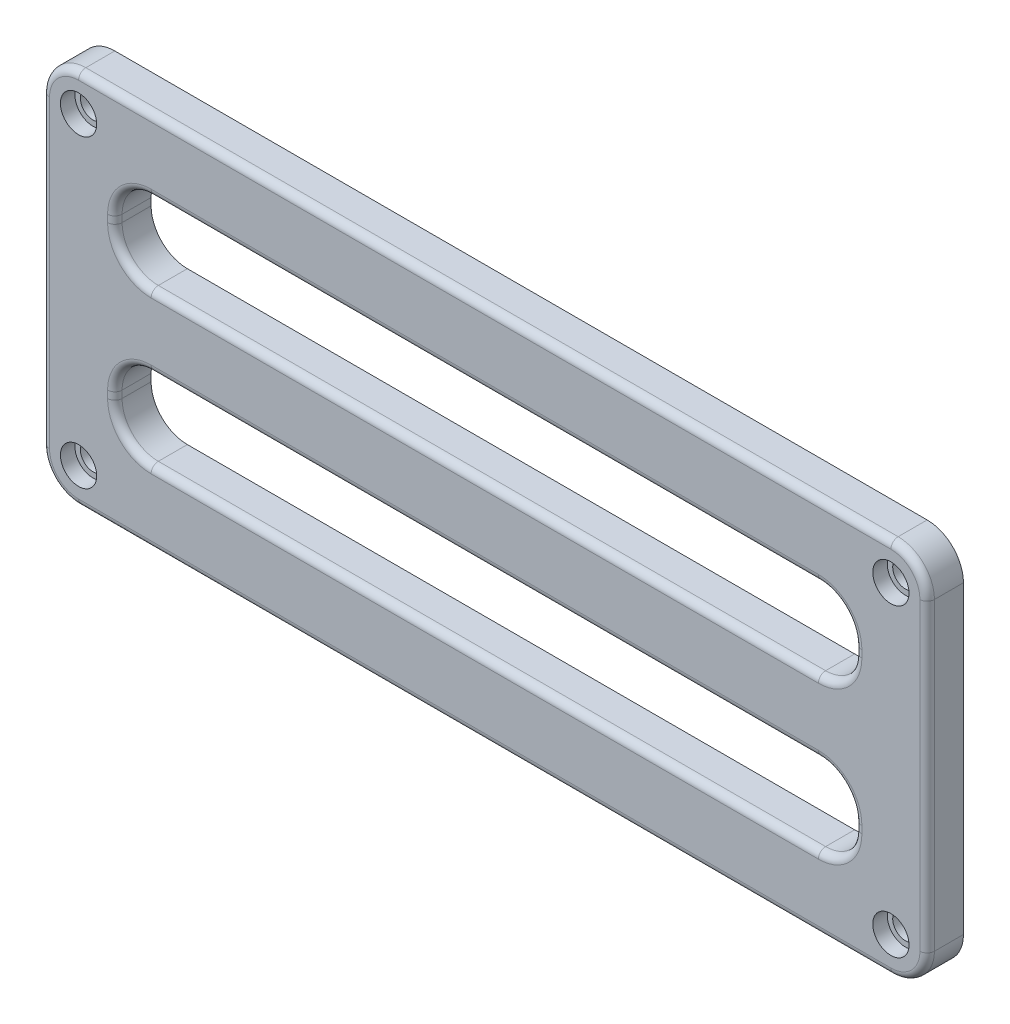
from build123d import *

# Parameters (mm, degrees)
SKETCH1_W           = 122
SKETCH1_H           = 52
SKETCH1_W_2         = 102
SKETCH1_H_2         = 32
BOSS_EXTRUDE1_DEPTH = 5
BOSS_EXTRUDE2_DEPTH = 5
SKETCH5_R           = 1.75
CUT_EXTRUDE2_DEPTH  = 120.720507851
SKETCH6_R           = 2.5
CUT_EXTRUDE3_DEPTH  = 2
FILLET1_R           = 5
FILLET2_R           = 1


with BuildPart() as part:
    # Sketch1 → Boss-Extrude1 (new body)
    with BuildSketch(Plane.XY):
        with Locations((51, 16)):
            Rectangle(SKETCH1_W, SKETCH1_H)
        with Locations((51, 16)):
            Rectangle(SKETCH1_W_2, SKETCH1_H_2, mode=Mode.SUBTRACT)
    extrude(amount=BOSS_EXTRUDE1_DEPTH)

    # Sketch2 → Boss-Extrude2 (add)
    with BuildSketch(Plane.XY.offset(5)):
        Polygon((0, 21), (102, 21), (102, 16), (102, 11), (0, 11), (0, 16), align=None)
    extrude(amount=-BOSS_EXTRUDE2_DEPTH)

    # Sketch5 → Cut-Extrude2 (cut, through all)
    with BuildSketch(Plane.XY.offset(5)):
        with Locations((-5, 37)):
            Circle(SKETCH5_R)
        with Locations((107, 37)):
            Circle(SKETCH5_R)
        with Locations((107, -5)):
            Circle(SKETCH5_R)
        with Locations((-5, -5)):
            Circle(SKETCH5_R)
    extrude(amount=-CUT_EXTRUDE2_DEPTH, mode=Mode.SUBTRACT)

    # Sketch6 → Cut-Extrude3 (cut)
    with BuildSketch(Plane.XY.offset(5)):
        with Locations((-5, 37)):
            Circle(SKETCH6_R)
        with Locations((107, 37)):
            Circle(SKETCH6_R)
        with Locations((107, -5)):
            Circle(SKETCH6_R)
        with Locations((-5, -5)):
            Circle(SKETCH6_R)
    extrude(amount=-CUT_EXTRUDE3_DEPTH, mode=Mode.SUBTRACT)

    # Fillet1
    fillet1_edges = [part.edges().sort_by_distance(p)[0] for p in [
        (0, 32, 2.5),
        (0, 0, 2.5),
        (102, 0, 2.5),
        (102, 32, 2.5),
        (0, 11, 2.5),
        (0, 21, 2.5),
        (102, 21, 2.5),
        (102, 11, 2.5),
        (-10, 42, 2.5),
        (112, 42, 2.5),
        (112, -10, 2.5),
        (-10, -10, 2.5),
    ]]
    fillet(fillet1_edges, radius=FILLET1_R)

    # Fillet2
    fillet2_edges = [part.edges().sort_by_distance(p)[0] for p in [
        (51, 21, 5),
        (0, 26.5, 5),
        (102, 26.5, 5),
        (51, 32, 5),
        (-10, 16, 5),
        (51, 42, 5),
        (51, -10, 5),
        (112, 16, 5),
        (-8.535533906, -8.535533906, 5),
        (110.535533906, -8.535533906, 5),
        (110.535533906, 40.535533906, 5),
        (-8.535533906, 40.535533906, 5),
        (1.464466094, 9.535533906, 5),
        (100.535533906, 1.464466094, 5),
        (100.535533906, 9.535533906, 5),
        (1.464466094, 1.464466094, 5),
        (1.464466094, 22.464466094, 5),
        (100.535533906, 22.464466094, 5),
        (100.535533906, 30.535533906, 5),
        (1.464466094, 30.535533906, 5),
        (0, 5.5, 5),
        (51, 11, 5),
        (51, 0, 5),
        (102, 5.5, 5),
    ]]
    fillet(fillet2_edges, radius=FILLET2_R)


solid = part.part
